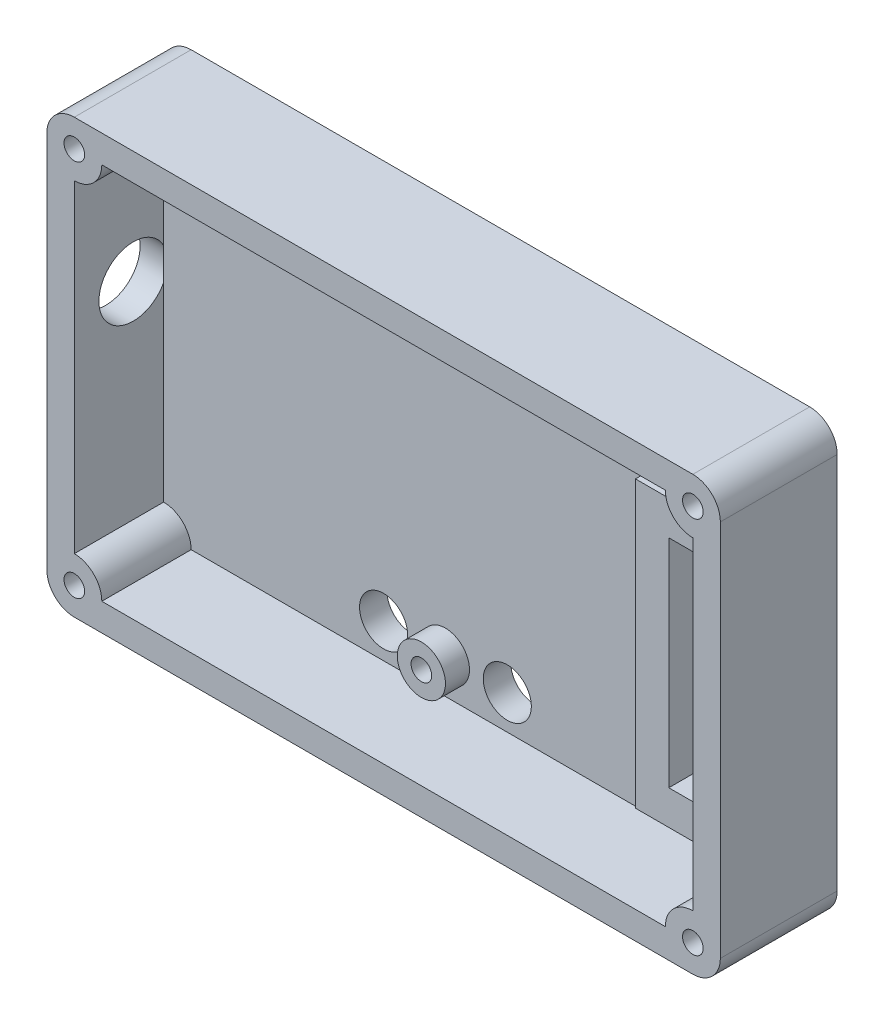
from build123d import *

# Parameters (mm, degrees)
ESQUISSE1_W             = 98
ESQUISSE1_H             = 63
ESQUISSE1_W_2           = 90
ESQUISSE1_H_2           = 55
BOSS_EXTRU_1_DEPTH      = 13
ESQUISSE2_W             = 98
ESQUISSE2_H             = 63
BOSS_EXTRU_2_DEPTH      = 4
ESQUISSE3_W             = 5
ESQUISSE3_H             = 31.5
BOSS_EXTRU_3_DEPTH      = 7
CONG_2_R                = 4
ESQUISSE6_R             = 4
BOSS_EXTRU_5_DEPTH      = 17
ESQUISSE7_R             = 1.5
ENL_V_MAT_EXTRU_2_DEPTH = 83.442016046
ESQUISSE8_R             = 3.5
ENL_V_MAT_EXTRU_3_DEPTH = 10
ESQUISSE9_R             = 3.5
ESQUISSE9_R_2           = 1.5
BOSS_EXTRU_6_DEPTH      = 3.5
ESQUISSE10_R            = 5
ENL_V_MAT_EXTRU_4_DEPTH = 4


with BuildPart() as part:
    # Esquisse1 → Boss.-Extru.1 (new body)
    with BuildSketch(Plane.XY):
        with Locations((35.11398795, 17.760869565)):
            Rectangle(ESQUISSE1_W, ESQUISSE1_H)
        with Locations((35.11398795, 17.760869565)):
            Rectangle(ESQUISSE1_W_2, ESQUISSE1_H_2, mode=Mode.SUBTRACT)
    extrude(amount=BOSS_EXTRU_1_DEPTH)

    # Esquisse2 → Boss.-Extru.2 (add)
    with BuildSketch(Plane(origin=(0, 0, 0), x_dir=(-1, 0, 0), z_dir=(0, 0, -1))):
        with Locations((-35.11398795, 17.760869565)):
            Rectangle(ESQUISSE2_W, ESQUISSE2_H)
    extrude(amount=BOSS_EXTRU_2_DEPTH)

    # Esquisse3 → Boss.-Extru.3 (add)
    with BuildSketch(Plane.XY):
        Polygon((80.11398795, 2.010869565), (80.11398795, 33.510869565), (80.11398795, 38.510869565), (65.766919995, 38.510869565), (65.766919995, 33.510869565), (65.766919995, 2.010869565), (65.766919995, -2.989130435), (80.11398795, -2.989130435), align=None)
        with Locations((73.11398795, 17.760869565)):
            Rectangle(ESQUISSE3_W, ESQUISSE3_H, mode=Mode.SUBTRACT)
    extrude(amount=BOSS_EXTRU_3_DEPTH)

    # Congé2
    cong_2_edges = [part.edges().sort_by_distance(p)[0] for p in [
        (-13.88601205, 49.260869565, 4.5),
        (84.11398795, 49.260869565, 4.5),
        (84.11398795, -13.739130435, 4.5),
        (-13.88601205, -13.739130435, 4.5),
    ]]
    fillet(cong_2_edges, radius=CONG_2_R)

    # Esquisse6 → Boss.-Extru.5 (add)
    with BuildSketch(Plane.XY.offset(13)):
        with Locations((-9.88601205, 45.260869565)):
            Circle(ESQUISSE6_R)
        with Locations((-9.88601205, -9.739130435)):
            Circle(ESQUISSE6_R)
        with Locations((80.11398795, -9.739130435)):
            Circle(ESQUISSE6_R)
        with Locations((80.11398795, 45.260869565)):
            Circle(ESQUISSE6_R)
    extrude(amount=-BOSS_EXTRU_5_DEPTH)

    # Esquisse7 → Enlèv. mat.-Extru.2 (cut)
    with BuildSketch(Plane.XY.offset(13)):
        with Locations((80.11398795, -9.739130435)):
            Circle(ESQUISSE7_R)
        with Locations((-9.88601205, -9.739130435)):
            Circle(ESQUISSE7_R)
        with Locations((-9.88601205, 45.260869565)):
            Circle(ESQUISSE7_R)
        with Locations((80.11398795, 45.260869565)):
            Circle(ESQUISSE7_R)
    extrude(amount=-ENL_V_MAT_EXTRU_2_DEPTH, mode=Mode.SUBTRACT)

    # Esquisse8 → Enlèv. mat.-Extru.3 (cut)
    with BuildSketch(Plane.XY):
        with Locations((22.11398795, -4.739130435)):
            Circle(ESQUISSE8_R)
        with Locations((40.11398795, -4.739130435)):
            Circle(ESQUISSE8_R)
    extrude(amount=-ENL_V_MAT_EXTRU_3_DEPTH, mode=Mode.SUBTRACT)

    # Esquisse9 → Boss.-Extru.6 (add)
    with BuildSketch(Plane.XY):
        with Locations((31.113164105, -4.617357959)):
            Circle(ESQUISSE9_R)
        with Locations((31.113164105, -4.617357959)):
            Circle(ESQUISSE9_R_2, mode=Mode.SUBTRACT)
    extrude(amount=BOSS_EXTRU_6_DEPTH)

    # Esquisse10 → Enlèv. mat.-Extru.4 (cut)
    with BuildSketch(Plane.ZY.offset(13.88601205)):
        with Locations(Location((4.424351408, 24.266648435, 0), (0, 0, 270))):
            Circle(ESQUISSE10_R)
    extrude(amount=-ENL_V_MAT_EXTRU_4_DEPTH, mode=Mode.SUBTRACT)


solid = part.part
